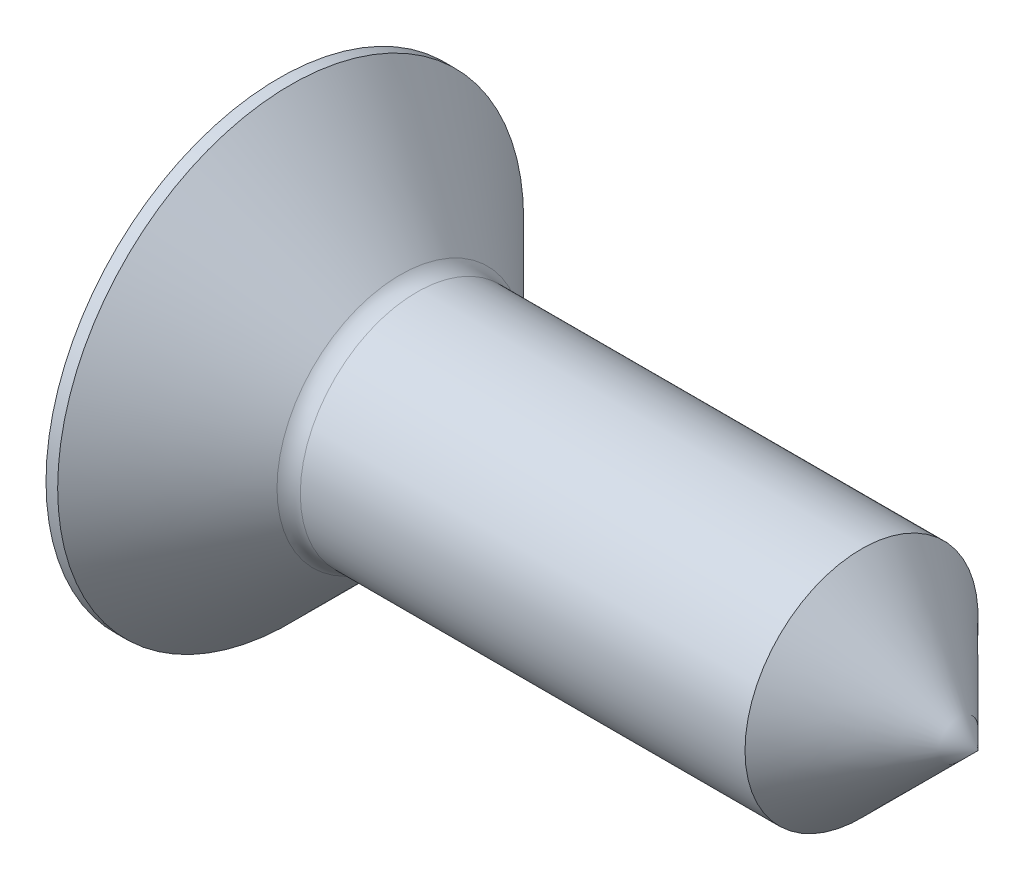
from build123d import *

# Parameters (mm, degrees)
FILLET2_R = 0.4


with BuildPart() as part:
    # Sketch1 → Base (revolve)
    with BuildSketch(Plane(origin=(0, 0, 0), x_dir=(1, 0, 0), z_dir=(0, 1, 0)), mode=Mode.PRIVATE) as base_sk:
        Polygon((2.2, 2), (12, 2), (12, 0), (0, 0), (0, 4), (0.2, 4), align=None)
    revolve(base_sk.sketch.rotate(Axis((-6.506452013, 0, 0), (1, 0, 0)), 180), axis=Axis((-6.506452013, 0, 0), (1, 0, 0)))

    # Sketch3 → Cut-Revolve1 (revolve, cut)
    with BuildSketch(Plane.XY, mode=Mode.PRIVATE) as cut_revolve1_sk:
        Polygon((12.15755877, 0), (12.15755877, 20), (-8, 20), (12, 0), align=None)
    revolve(cut_revolve1_sk.sketch.rotate(Axis((4.883468835, 0, 0), (1, 0, 0)), 90), axis=Axis((4.883468835, 0, 0), (1, 0, 0)), mode=Mode.SUBTRACT)

    # Fillet2
    fillet2_edges = [part.edges().sort_by_distance(p)[0] for p in [
        (2.2, 0, -2),
    ]]
    fillet(fillet2_edges, radius=FILLET2_R)

    # Sketch2 → Cut-Loft1 section 0
    with BuildSketch(Plane(origin=(0, -0.680816871, 0.306758275), x_dir=(0, 0, 1), z_dir=(-1, 0, 0)), mode=Mode.PRIVATE) as cut_loft1_s0:
        with BuildLine():
            Line((-0.786758275, 1.160816871), (-2.706758275, 1.160816871))
            Line((-2.706758275, 1.160816871), (-2.706758275, 0.200816871))
            Line((-2.706758275, 0.200816871), (-0.786758275, 0.200816871))
            Line((-0.786758275, 0.200816871), (-0.786758275, -1.719183129))
            Line((-0.786758275, -1.719183129), (0.173241725, -1.719183129))
            Line((0.173241725, -1.719183129), (0.173241725, 0.200816871))
            Line((0.173241725, 0.200816871), (2.093241725, 0.200816871))
            Line((2.093241725, 0.200816871), (2.093241725, 1.160816871))
            Line((2.093241725, 1.160816871), (0.173241725, 1.160816871))
            Line((0.173241725, 1.160816871), (0.173241725, 3.080816871))
            Line((0.173241725, 3.080816871), (-0.786758275, 3.080816871))
            Line((-0.786758275, 3.080816871), (-0.786758275, 1.160816871))
        make_face()
    loft([cut_loft1_s0.sketch, Vertex(2.45, 0, 0)], mode=Mode.SUBTRACT)


solid = part.part
